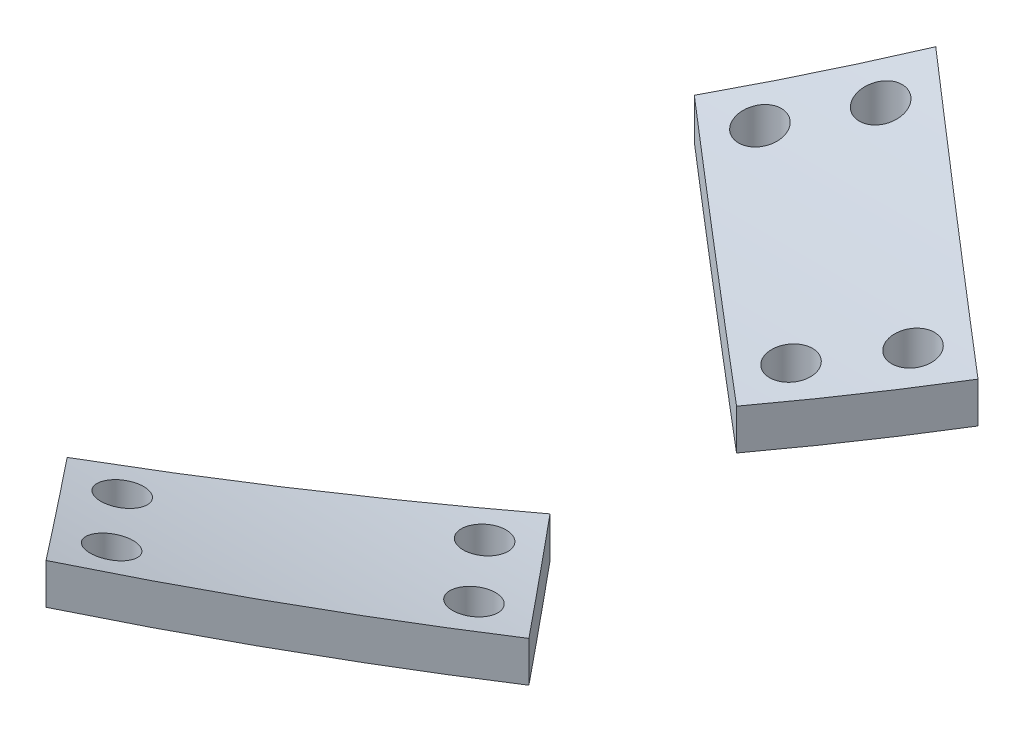
from build123d import *

# Parameters (mm, degrees)
BOSS_EXTRUDE4_DEPTH = 304.8
SKETCH4_W           = 120.367414929
SKETCH4_H           = 199.720747733
CUT_EXTRUDE20_DEPTH = 200
SKETCH4_17_R        = 3.175
CUT_EXTRUDE21_DEPTH = 200


with BuildPart() as part:
    # Sketch3 → Boss-Extrude4 (new body)
    with BuildSketch(Plane(origin=(0, 0, 0), x_dir=(0, 0, -1), z_dir=(1, 0, 0))):
        with BuildLine():
            ThreePointArc((232.90669496, 1.961354585), (112.25669496, -30.366715482), (-8.39330504, 1.961354585))
            Line((-8.39330504, 1.961354585), (-8.39330504, -4.052041589))
            ThreePointArc((-8.39330504, -4.052041589), (112.25669496, -36.380111656), (232.90669496, -4.052041589))
            Line((232.90669496, -4.052041589), (232.90669496, 1.961354585))
        make_face()
    extrude(amount=BOSS_EXTRUDE4_DEPTH)

    # Sketch4 → Cut-Extrude20 (cut)
    with BuildSketch(Plane(origin=(0, 1.961354585, 0), x_dir=(1, 0, 0), z_dir=(0, 1, 0))):
        with Locations((227.963988261, 108.244447796)):
            Rectangle(SKETCH4_W, SKETCH4_H)
        Polygon((264.373807825, 78.97597139), (225.458750115, 46.322360818), (214.460227487, 59.429889674), (209.131944829, 65.779889674), (213.996327043, 69.861590995), (248.047002539, 98.433500246), align=None, mode=Mode.SUBTRACT)
        Polygon((248.047002539, 126.079889674), (209.131944829, 158.733500246), (225.458750115, 178.191029101), (264.373807825, 145.537418529), align=None, mode=Mode.SUBTRACT)
    extrude(amount=-CUT_EXTRUDE20_DEPTH, mode=Mode.SUBTRACT)


with BuildPart() as cut_extrude20_piece_1:
    # of the separate pieces the step leaves, piece 1, a body of its own (cut_extrude20_pieces_kept)
    add(part.part.solids().sort_by_distance((225.458750115, -21.183827263, -178.191029101))[0])


with BuildPart() as cut_extrude20_piece_2:
    # of the separate pieces the step leaves, piece 2, a body of its own (cut_extrude20_pieces_kept)
    add(part.part.solids().sort_by_distance((209.131944829, -25.848464294, -65.779889674))[0])


with BuildPart() as cut_extrude21_tool:
    # Sketch4<17> → Cut-Extrude21 (new body)
    with BuildSketch(Plane(origin=(0, 1.961354585, 0), x_dir=(1, 0, 0), z_dir=(0, 1, 0))):
        with Locations((218.078028364, 64.997208781)):
            Circle(SKETCH4_17_R)
        with Locations((247.238208457, 89.553149912)):
            Circle(SKETCH4_17_R)
        with Locations((226.241431007, 55.268444354)):
            Circle(SKETCH4_17_R)
        with Locations((255.487924349, 79.72152136)):
            Circle(SKETCH4_17_R)
        with Locations((226.241431007, 169.244945565)):
            Circle(SKETCH4_17_R)
        with Locations((255.487924349, 144.791868559)):
            Circle(SKETCH4_17_R)
        with Locations((218.078028364, 159.516181138)):
            Circle(SKETCH4_17_R)
        with Locations((247.238208457, 134.960240007)):
            Circle(SKETCH4_17_R)
    extrude(amount=-CUT_EXTRUDE21_DEPTH)


with BuildPart() as cut_extrude20_piece_1_1:
    add(cut_extrude20_piece_1.part)

    # Cut-Extrude21: cut by cut_extrude21_tool
    add(cut_extrude21_tool.part, mode=Mode.SUBTRACT)


with BuildPart() as cut_extrude20_piece_2_1:
    add(cut_extrude20_piece_2.part)

    # Cut-Extrude21: cut by cut_extrude21_tool
    add(cut_extrude21_tool.part, mode=Mode.SUBTRACT)


solid = Compound([cut_extrude20_piece_1_1.part, cut_extrude20_piece_2_1.part])
